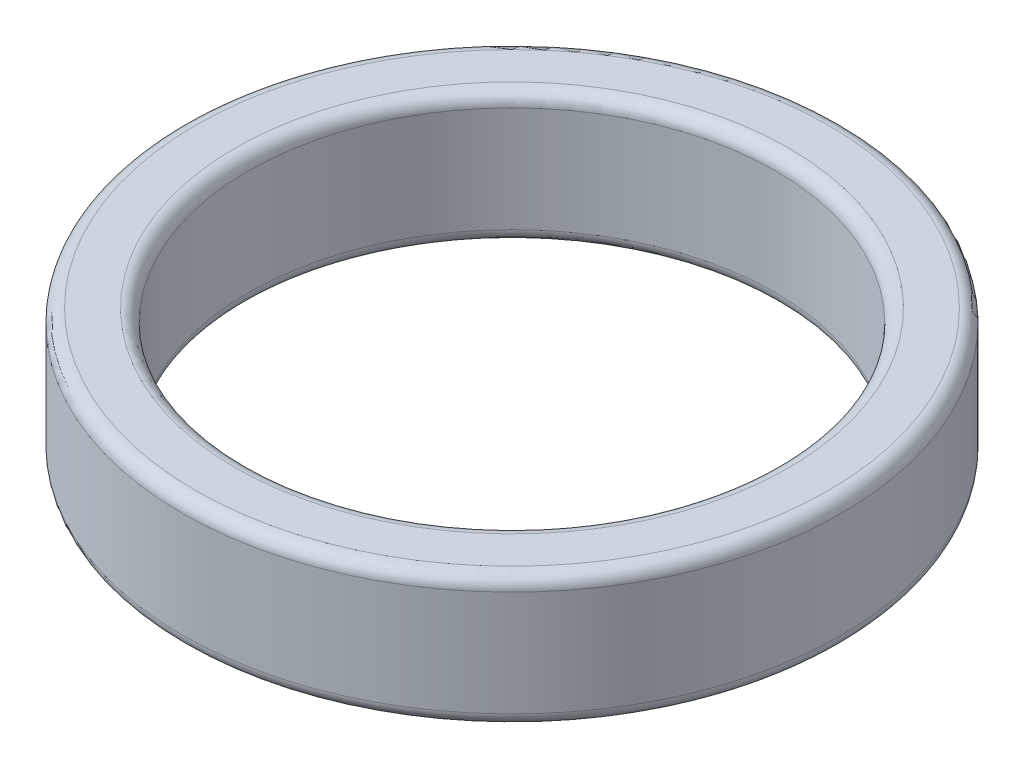
from build123d import *

# Parameters (mm, degrees)
ESQUISSE1_R        = 12.5
ESQUISSE1_R_2      = 10
BOSS_EXTRU_1_DEPTH = 5
CONG_1_R           = 0.5


with BuildPart() as part:
    # Esquisse1 → Boss.-Extru.1 (new body)
    with BuildSketch(Plane(origin=(0, 0, 0), x_dir=(1, 0, 0), z_dir=(0, 1, 0))):
        with Locations(Location((0, 0, 0), (0, 0, 270))):
            Circle(ESQUISSE1_R)
        with Locations(Location((0, 0, 0), (0, 0, 270))):
            Circle(ESQUISSE1_R_2, mode=Mode.SUBTRACT)
    extrude(amount=BOSS_EXTRU_1_DEPTH)

    # Congé1
    cong_1_edges = [part.edges().sort_by_distance(p)[0] for p in [
        (0, 0, -12.5),
        (0, 5, -12.5),
        (0, 0, -10),
        (0, 5, -10),
    ]]
    fillet(cong_1_edges, radius=CONG_1_R)


solid = part.part
